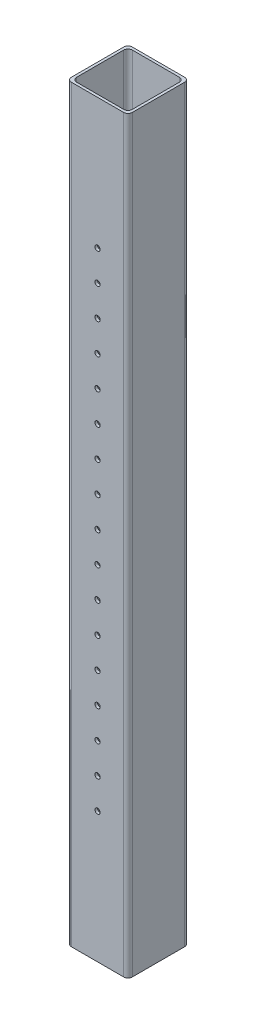
from build123d import *

# Parameters (mm, degrees)
SKETCH1_W           = 70
SKETCH1_H           = 70
SKETCH1_W_2         = 64
SKETCH1_H_2         = 64
BOSS_EXTRUDE1_DEPTH = 860
FILLET1_R           = 5
SKETCH2_R           = 3
CUT_EXTRUDE1_DEPTH  = 70
LPATTERN1_COUNT     = 9
LPATTERN1_PITCH     = 35
LPATTERN1_COL_COUNT = 9
LPATTERN1_COL_PITCH = 35


with BuildPart() as part:
    # Sketch1 → Boss-Extrude1 (new body)
    with BuildSketch(Plane(origin=(0, 0, 0), x_dir=(1, 0, 0), z_dir=(0, 1, 0))):
        with Locations((35, 35)):
            Rectangle(SKETCH1_W, SKETCH1_H)
        with Locations((35, 35)):
            Rectangle(SKETCH1_W_2, SKETCH1_H_2, mode=Mode.SUBTRACT)
    extrude(amount=BOSS_EXTRUDE1_DEPTH)

    # Fillet1
    fillet1_edges = [part.edges().sort_by_distance(p)[0] for p in [
        (3, 430, -67),
        (3, 430, -3),
        (67, 430, -3),
        (67, 430, -67),
        (0, 430, 0),
        (0, 430, -70),
        (70, 430, -70),
        (70, 430, 0),
    ]]
    fillet(fillet1_edges, radius=FILLET1_R)

    # Sketch2 → Cut-Extrude1 (cut)
    with BuildSketch(Plane(origin=(0, 0, -70), x_dir=(-1, 0, 0), z_dir=(0, 0, -1))):
        with Locations((-35, 430)):
            Circle(SKETCH2_R)
    cut_extrude1 = extrude(amount=-CUT_EXTRUDE1_DEPTH, mode=Mode.SUBTRACT)

    # LPattern1: Cut-Extrude1 ×9
    with Locations(*[(0, -i * LPATTERN1_PITCH, 0) for i in range(1, LPATTERN1_COUNT)]):
        add(cut_extrude1, mode=Mode.SUBTRACT)

    # LPattern1 col: Cut-Extrude1 ×9
    with Locations(*[(0, i * LPATTERN1_COL_PITCH, 0) for i in range(1, LPATTERN1_COL_COUNT)]):
        add(cut_extrude1, mode=Mode.SUBTRACT)


solid = part.part
